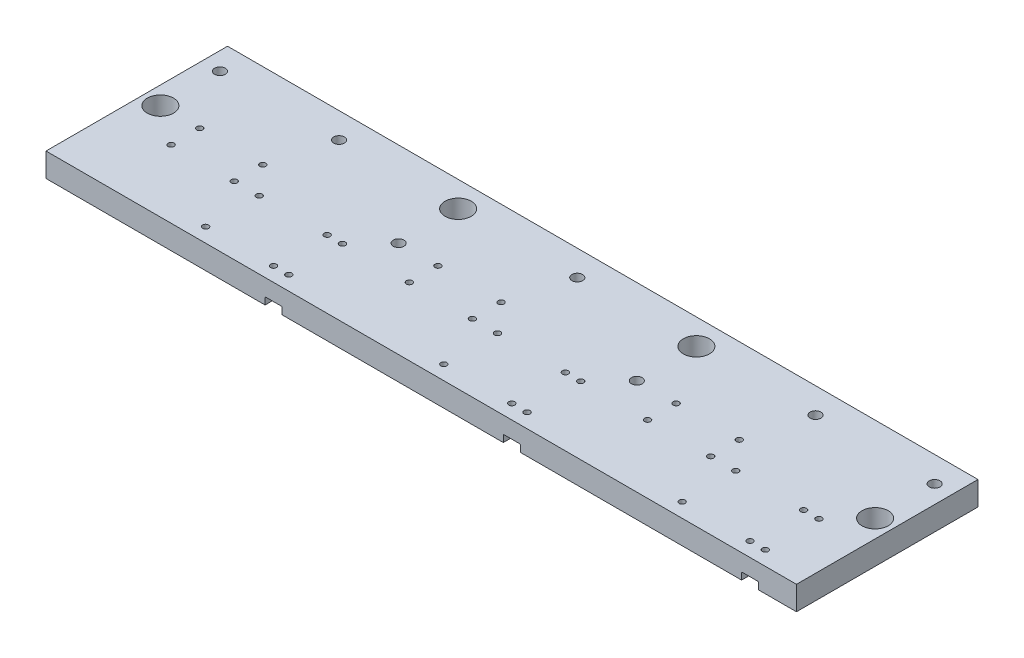
from build123d import *

# Parameters (mm, degrees)
SKETCH1_W             = 630
SKETCH1_H             = 152.4
BOSS_EXTRUDE1_DEPTH   = 12.7
SKETCH8_W             = 630
SKETCH8_H             = 2.7
CUT_EXTRUDE1_DEPTH    = 351.160034841
BOSS_EXTRUDE2_REACH   = 326.702
M8_CLEARANCE_HOLE1_D  = 9
M20_CLEARANCE_HOLE1_D = 22
M6_TAPPED_HOLE2_D     = 5
M6_TAPPED_HOLE2_DEPTH = 27.99
M6_TAPPED_HOLE2_TIP   = 1.502151548
M6_TAPPED_HOLE5_D     = 5
M6_TAPPED_HOLE5_DEPTH = 27.99
M6_TAPPED_HOLE5_TIP   = 1.502151548
M6_TAPPED_HOLE6_D     = 5
M6_TAPPED_HOLE6_DEPTH = 27.99
M6_TAPPED_HOLE6_TIP   = 1.502151548
M6_TAPPED_HOLE3_D     = 5
M6_TAPPED_HOLE3_DEPTH = 27.99
M6_TAPPED_HOLE3_TIP   = 1.502151548
M6_TAPPED_HOLE7_D     = 5
M6_TAPPED_HOLE7_DEPTH = 27.99
M6_TAPPED_HOLE7_TIP   = 1.502151548
M6_TAPPED_HOLE8_D     = 5
M6_TAPPED_HOLE8_DEPTH = 27.99
M6_TAPPED_HOLE8_TIP   = 1.502151548
FILLET1_R             = 0.79375


with BuildPart() as part:
    # Sketch1 → Boss-Extrude1 (new, symmetric)
    with BuildSketch(Plane(origin=(0, 0, 0), x_dir=(1, 0, 0), z_dir=(0, 1, 0))):
        Rectangle(SKETCH1_W, SKETCH1_H)
    extrude(amount=BOSS_EXTRUDE1_DEPTH, both=True)

    # Sketch8 → Cut-Extrude1 (cut, through all)
    with BuildSketch(Plane(origin=(0, 0, 76.2), x_dir=(-1, 0, 0), z_dir=(0, 0, -1))):
        Polygon((-83.2, -10), (-83.2, -4), (-68.9125, -4), (-68.9125, -10), (116.8, -10), (116.8, -4), (131.0875, -4), (131.0875, -10), (315, -10), (315, -12.7), (-315, -12.7), (-315, -10), (-283.2, -10), (-283.2, -4), (-268.9125, -4), (-268.9125, -10), align=None)
        with Locations((0, 11.35)):
            Rectangle(SKETCH8_W, SKETCH8_H)
    extrude(amount=CUT_EXTRUDE1_DEPTH, mode=Mode.SUBTRACT)

    # Sketch23 → Boss-Extrude2 (add, up to next)
    with BuildSketch(Plane.XZ.offset(10), mode=Mode.PRIVATE) as boss_extrude2_sk1:
        with BuildLine():
            Line((-116.8, 6.35), (-116.8, -76.2))
            Line((-116.8, -76.2), (-131.0875, -76.2))
            Line((-131.0875, -76.2), (-131.0875, 6.35))
            ThreePointArc((-131.0875, 6.35), (-123.94375, -0.79375), (-116.8, 6.35))
        make_face()
    boss_extrude2_tool1 = extrude(boss_extrude2_sk1.sketch, amount=-BOSS_EXTRUDE2_REACH, mode=Mode.PRIVATE) - part.part
    # Sketch23 → Boss-Extrude2 (add, up to next)
    with BuildSketch(Plane.XZ.offset(10), mode=Mode.PRIVATE) as boss_extrude2_sk2:
        with BuildLine():
            Line((68.9125, 6.35), (68.9125, -76.2))
            Line((68.9125, -76.2), (83.2, -76.2))
            Line((83.2, -76.2), (83.2, 6.35))
            ThreePointArc((83.2, 6.35), (76.05625, -0.79375), (68.9125, 6.35))
        make_face()
    boss_extrude2_tool2 = extrude(boss_extrude2_sk2.sketch, amount=-BOSS_EXTRUDE2_REACH, mode=Mode.PRIVATE) - part.part
    # Sketch23 → Boss-Extrude2 (add, up to next)
    with BuildSketch(Plane.XZ.offset(10), mode=Mode.PRIVATE) as boss_extrude2_sk3:
        with BuildLine():
            Line((268.9125, 6.35), (268.9125, -76.2))
            Line((268.9125, -76.2), (283.2, -76.2))
            Line((283.2, -76.2), (283.2, 6.35))
            ThreePointArc((283.2, 6.35), (276.05625, -0.79375), (268.9125, 6.35))
        make_face()
    boss_extrude2_tool3 = extrude(boss_extrude2_sk3.sketch, amount=-BOSS_EXTRUDE2_REACH, mode=Mode.PRIVATE) - part.part
    add(boss_extrude2_tool1.solids().sort_by_distance((-123.94375, -10, -37.713823))[0])
    add(boss_extrude2_tool2.solids().sort_by_distance((76.05625, -10, -37.713823))[0])
    add(boss_extrude2_tool3.solids().sort_by_distance((276.05625, -10, -37.713823))[0])

    # M8 Clearance Hole1 (through all)
    with Locations(Plane(origin=(-252.085824098, -10, 54.789326217), x_dir=(-1, 0, 0), z_dir=(0, -1, 0))):
        with Locations((47.914175902, 109.589326217), (-52.085824098, 109.589326217), (-152.085824098, 59.589326217), (-252.085824098, 109.589326217), (-352.085824098, 59.589326217), (-452.085824098, 109.589326217), (-552.085824098, 109.589326217)):
            Hole(M8_CLEARANCE_HOLE1_D / 2)

    # M20 Clearance Hole1 (through all)
    with Locations(Plane(origin=(-106.699185936, -10, 17.134873145), x_dir=(-1, 0, 0), z_dir=(0, -1, 0))):
        with Locations((193.300814064, 21.934873145), (-406.699185936, 21.934873145), (-206.699185936, 71.934873145), (-6.699185936, 71.934873145)):
            Hole(M20_CLEARANCE_HOLE1_D / 2)

    # M6 Tapped Hole2
    with Locations(Plane(origin=(-22.829775721, -10, 14.438586314), x_dir=(-1, 0, 0), z_dir=(0, -1, 0))):
        with Locations((-155.829775721, -4.761413686), (-208.829775721, 19.238586314), (-155.829775721, 19.238586314), (-208.829775721, -4.761413686), (-229.829775721, -49.761413686), (-286.829775721, -4.761413686), (-229.829775721, -4.761413686), (-286.829775721, -49.761413686)):
            Hole(M6_TAPPED_HOLE2_D / 2, depth=M6_TAPPED_HOLE2_DEPTH)
            with Locations((0, 0, -(M6_TAPPED_HOLE2_DEPTH + M6_TAPPED_HOLE2_TIP / 2))):  # 118° drill point
                Cone(0, M6_TAPPED_HOLE2_D / 2, M6_TAPPED_HOLE2_TIP, mode=Mode.SUBTRACT)

    # M6 Tapped Hole5
    with Locations(Plane(origin=(0, -10, 0), x_dir=(-1, 0, 0), z_dir=(0, -1, 0))):
        with Locations((14, 4.8), (67, -19.2), (14, -19.2), (67, 4.8), (-64, -19.2), (-7, -64.2), (-64, -64.2), (-7, -19.2)):
            Hole(M6_TAPPED_HOLE5_D / 2, depth=M6_TAPPED_HOLE5_DEPTH)
            with Locations((0, 0, -(M6_TAPPED_HOLE5_DEPTH + M6_TAPPED_HOLE5_TIP / 2))):  # 118° drill point
                Cone(0, M6_TAPPED_HOLE5_D / 2, M6_TAPPED_HOLE5_TIP, mode=Mode.SUBTRACT)

    # M6 Tapped Hole6
    with Locations(Plane(origin=(0, -10, 0), x_dir=(-1, 0, 0), z_dir=(0, -1, 0))):
        with Locations((136, -19.2), (193, -64.2), (136, -64.2), (193, -19.2), (214, 4.8), (267, -19.2), (214, -19.2), (267, 4.8)):
            Hole(M6_TAPPED_HOLE6_D / 2, depth=M6_TAPPED_HOLE6_DEPTH)
            with Locations((0, 0, -(M6_TAPPED_HOLE6_DEPTH + M6_TAPPED_HOLE6_TIP / 2))):  # 118° drill point
                Cone(0, M6_TAPPED_HOLE6_D / 2, M6_TAPPED_HOLE6_TIP, mode=Mode.SUBTRACT)

    # M6 Tapped Hole3
    with Locations(Plane(origin=(0, -4, 0), x_dir=(-1, 0, 0), z_dir=(0, -1, 0))):
        with Locations((-276.85, -19.2), (-276.85, -64.2)):
            Hole(M6_TAPPED_HOLE3_D / 2, depth=M6_TAPPED_HOLE3_DEPTH)
            with Locations((0, 0, -(M6_TAPPED_HOLE3_DEPTH + M6_TAPPED_HOLE3_TIP / 2))):  # 118° drill point
                Cone(0, M6_TAPPED_HOLE3_D / 2, M6_TAPPED_HOLE3_TIP, mode=Mode.SUBTRACT)

    # M6 Tapped Hole7
    with Locations(Plane(origin=(0, -4, 0), x_dir=(-1, 0, 0), z_dir=(0, -1, 0))):
        with Locations((-76.85, -19.2), (-76.85, -64.2)):
            Hole(M6_TAPPED_HOLE7_D / 2, depth=M6_TAPPED_HOLE7_DEPTH)
            with Locations((0, 0, -(M6_TAPPED_HOLE7_DEPTH + M6_TAPPED_HOLE7_TIP / 2))):  # 118° drill point
                Cone(0, M6_TAPPED_HOLE7_D / 2, M6_TAPPED_HOLE7_TIP, mode=Mode.SUBTRACT)

    # M6 Tapped Hole8
    with Locations(Plane(origin=(0, -4, 0), x_dir=(-1, 0, 0), z_dir=(0, -1, 0))):
        with Locations((123.15, -19.2), (123.15, -64.2)):
            Hole(M6_TAPPED_HOLE8_D / 2, depth=M6_TAPPED_HOLE8_DEPTH)
            with Locations((0, 0, -(M6_TAPPED_HOLE8_DEPTH + M6_TAPPED_HOLE8_TIP / 2))):  # 118° drill point
                Cone(0, M6_TAPPED_HOLE8_D / 2, M6_TAPPED_HOLE8_TIP, mode=Mode.SUBTRACT)

    # Fillet1
    fillet1_edges = [part.edges().sort_by_distance(p)[0] for p in [
        (283.2, -4, 41.275),
        (268.9125, -4, 41.275),
        (276.05625, -4, -0.79375),
        (-116.8, -4, 41.275),
        (-131.0875, -4, 41.275),
        (-123.94375, -4, -0.79375),
        (83.2, -4, 41.275),
        (68.9125, -4, 41.275),
        (76.05625, -4, -0.79375),
    ]]
    fillet(fillet1_edges, radius=FILLET1_R)


solid = part.part
